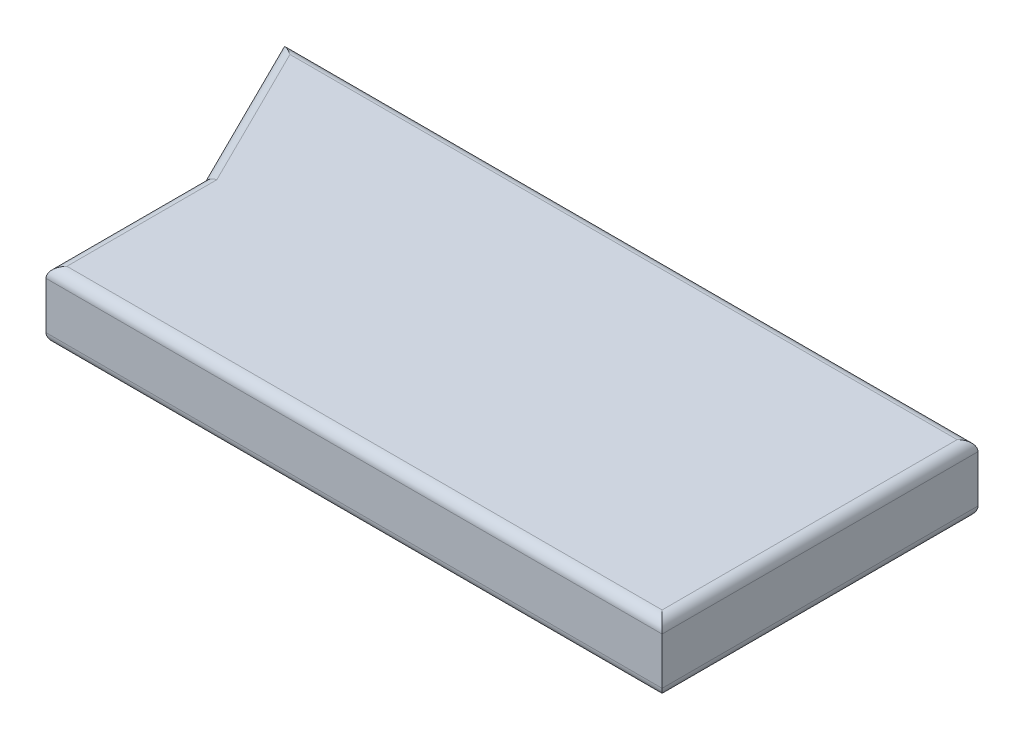
from build123d import *

# Parameters (mm, degrees)
SKETCH_1_W      = 118
SKETCH_1_H      = 60.5
EXTRUDE_1_DEPTH = 13
FILLET_1_R      = 2
FILLET_2_R      = 2


with BuildPart() as part:
    # 草图1 → 凸台-拉伸1 (new body)
    with BuildSketch(Plane(origin=(0, 0, 0), x_dir=(1, 0, 0), z_dir=(0, 1, 0))):
        Polygon((-59, 0), (-59, 30.25), (-74, 30.25), align=None)
        Rectangle(SKETCH_1_W, SKETCH_1_H)
    extrude(amount=EXTRUDE_1_DEPTH)

    # 圆角1
    fillet_1_edges = [part.edges().sort_by_distance(p)[0] for p in [
        (-66.5, 13, -15.125),
        (-59, 13, 15.125),
        (0, 13, 30.25),
        (59, 13, 0),
        (-7.5, 13, -30.25),
    ]]
    fillet(fillet_1_edges, radius=FILLET_1_R)

    # 圆角2
    fillet_2_edges = [part.edges().sort_by_distance(p)[0] for p in [
        (59, 0, 0),
        (0, 0, 30.25),
        (-59, 0, 15.125),
        (-66.5, 0, -15.125),
        (-7.5, 0, -30.25),
    ]]
    fillet(fillet_2_edges, radius=FILLET_2_R)


solid = part.part
